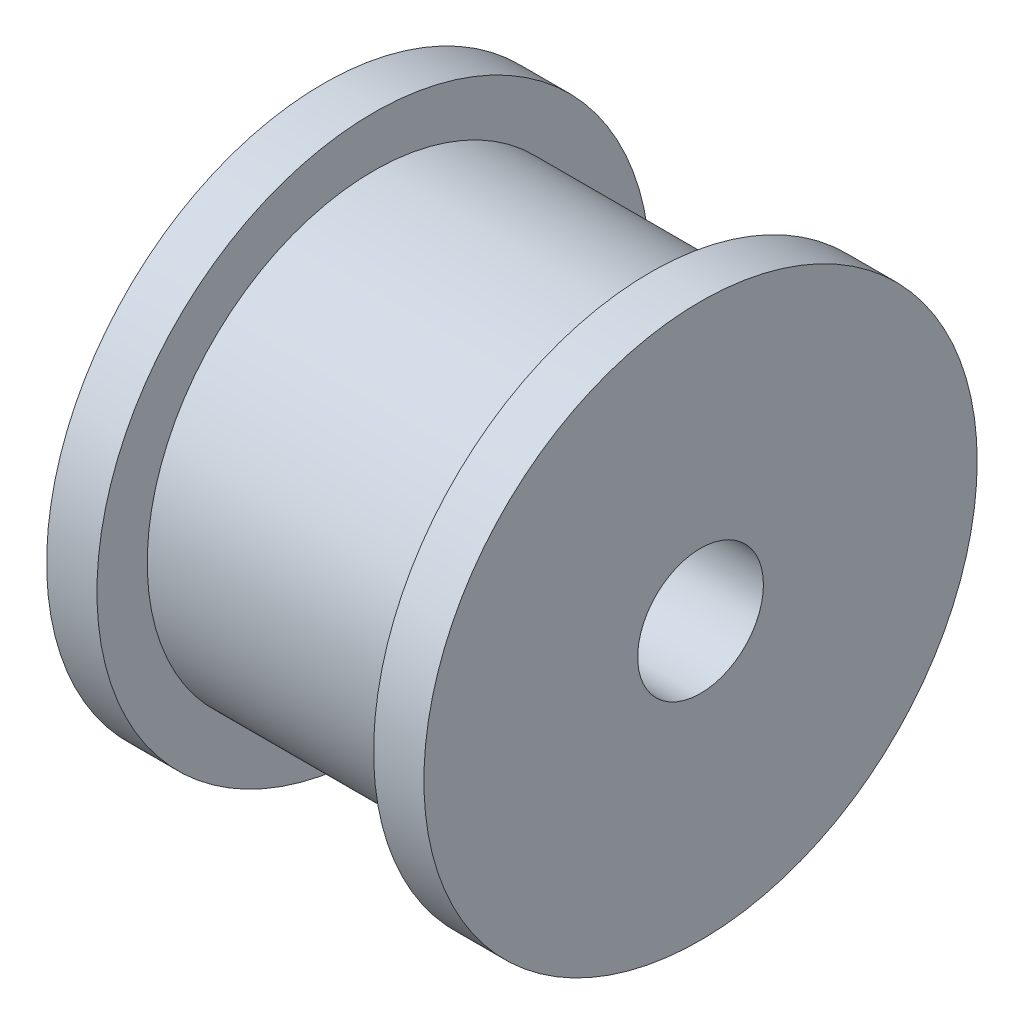
from build123d import *

# Parameters (mm, degrees)
SKETCH_1_R      = 11
SKETCH_1_R_2    = 2.5
EXTRUDE_1_DEPTH = 2
SKETCH_2_R      = 9
SKETCH_2_R_2    = 2.5
EXTRUDE_2_DEPTH = 11
SKETCH_3_R      = 11
SKETCH_3_R_2    = 2.5
EXTRUDE_3_DEPTH = 2


with BuildPart() as part:
    # 草图1 → 凸台-拉伸1 (new body)
    with BuildSketch(Plane(origin=(0, 0, 0), x_dir=(0, 0, -1), z_dir=(1, 0, 0))):
        Circle(SKETCH_1_R)
        Circle(SKETCH_1_R_2, mode=Mode.SUBTRACT)
    extrude(amount=EXTRUDE_1_DEPTH)

    # 草图2 → 凸台-拉伸2 (add)
    with BuildSketch(Plane(origin=(2, 0, 0), x_dir=(0, 0, -1), z_dir=(1, 0, 0))):
        Circle(SKETCH_2_R)
        Circle(SKETCH_2_R_2, mode=Mode.SUBTRACT)
    extrude(amount=EXTRUDE_2_DEPTH)

    # 草图3 → 凸台-拉伸3 (add)
    with BuildSketch(Plane(origin=(13, 0, 0), x_dir=(0, 0, -1), z_dir=(1, 0, 0))):
        Circle(SKETCH_3_R)
        Circle(SKETCH_3_R_2, mode=Mode.SUBTRACT)
    extrude(amount=EXTRUDE_3_DEPTH)


solid = part.part
